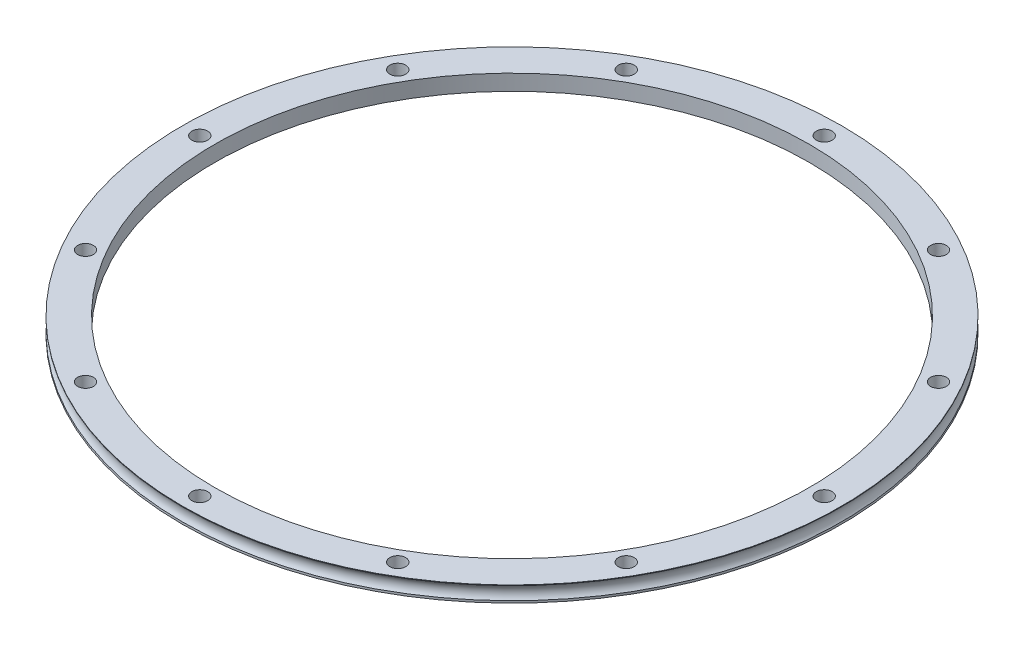
from build123d import *

# Parameters (mm, degrees)
SKETCH3_R          = 1.6
CUT_EXTRUDE1_DEPTH = 95.098950047
CIRPATTERN1_COUNT  = 12


with BuildPart() as part:
    # Sketch1 → Revolve1 (revolve)
    with BuildSketch(Plane.XY, mode=Mode.PRIVATE) as revolve1_sk:
        with BuildLine():
            Line((-66.5, 9.851956719), (-66.5, 9.965))
            Line((-66.5, 9.965), (-60, 9.965))
            Line((-60, 9.965), (-60, 6.785))
            Line((-60, 6.785), (-66.5, 6.785))
            Line((-66.5, 6.785), (-66.5, 7.218043281))
            ThreePointArc((-66.5, 7.218043281), (-66, 8.535), (-66.5, 9.851956719))
        make_face()
    revolve(revolve1_sk.sketch.rotate(Axis((0, -200069.047495165, 0), (0, 1, 0)), 270), axis=Axis((0, -200069.047495165, 0), (0, 1, 0)))

    # Sketch3 → Cut-Extrude1 (cut, through all)
    with BuildSketch(Plane(origin=(0, 9.965, 0), x_dir=(1, 0, 0), z_dir=(0, 1, 0))):
        with Locations(Location((0, 63, 0), (0, 0, 270))):
            Circle(SKETCH3_R)
    cut_extrude1 = extrude(amount=-CUT_EXTRUDE1_DEPTH, mode=Mode.SUBTRACT)

    # CirPattern1: Cut-Extrude1 ×12 about axis
    cirpattern1_axis = Axis((0, 0, 0), (0, 1, 0))
    for i in range(1, CIRPATTERN1_COUNT):
        add(cut_extrude1.rotate(cirpattern1_axis, i * 360 / CIRPATTERN1_COUNT), mode=Mode.SUBTRACT)


solid = part.part
